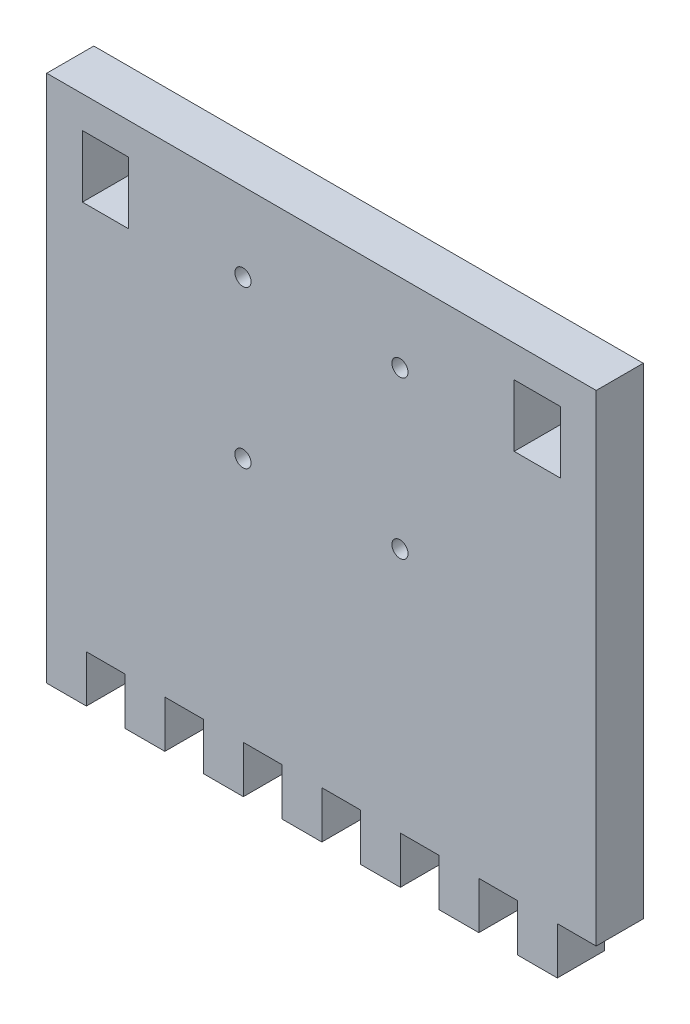
from build123d import *

# Parameters (mm, degrees)
ESQUISSE1_R        = 1.03
ESQUISSE1_W        = 5.9
ESQUISSE1_H        = 7.9
BOSS_EXTRU_1_DEPTH = 6


with BuildPart() as part:
    # Esquisse1 → Boss.-Extru.1 (new body)
    with BuildSketch(Plane.XY):
        Polygon((0, 0), (0, 67.3), (70, 67.3), (70, 6), (65.05, 6), (65.05, 0), (60, 0), (60, 6), (55.05, 6), (55.05, 0), (50, 0), (50, 6), (45.05, 6), (45.05, 0), (40, 0), (40, 6), (35.05, 6), (35.05, 0), (30, 0), (30, 6), (25.05, 6), (25.05, 0), (20, 0), (20, 6), (15.05, 6), (15.05, 0), (10, 0), (10, 6), (5.05, 6), (5.05, 0), align=None)
        with Locations((25, 57.3)):
            Circle(ESQUISSE1_R, mode=Mode.SUBTRACT)
        with Locations((45, 57.3)):
            Circle(ESQUISSE1_R, mode=Mode.SUBTRACT)
        with Locations((25, 37.3)):
            Circle(ESQUISSE1_R, mode=Mode.SUBTRACT)
        with Locations((45, 37.3)):
            Circle(ESQUISSE1_R, mode=Mode.SUBTRACT)
        with Locations((7.5, 59.3)):
            Rectangle(ESQUISSE1_W, ESQUISSE1_H, mode=Mode.SUBTRACT)
        with Locations((62.5, 59.3)):
            Rectangle(ESQUISSE1_W, ESQUISSE1_H, mode=Mode.SUBTRACT)
    extrude(amount=BOSS_EXTRU_1_DEPTH)


solid = part.part
